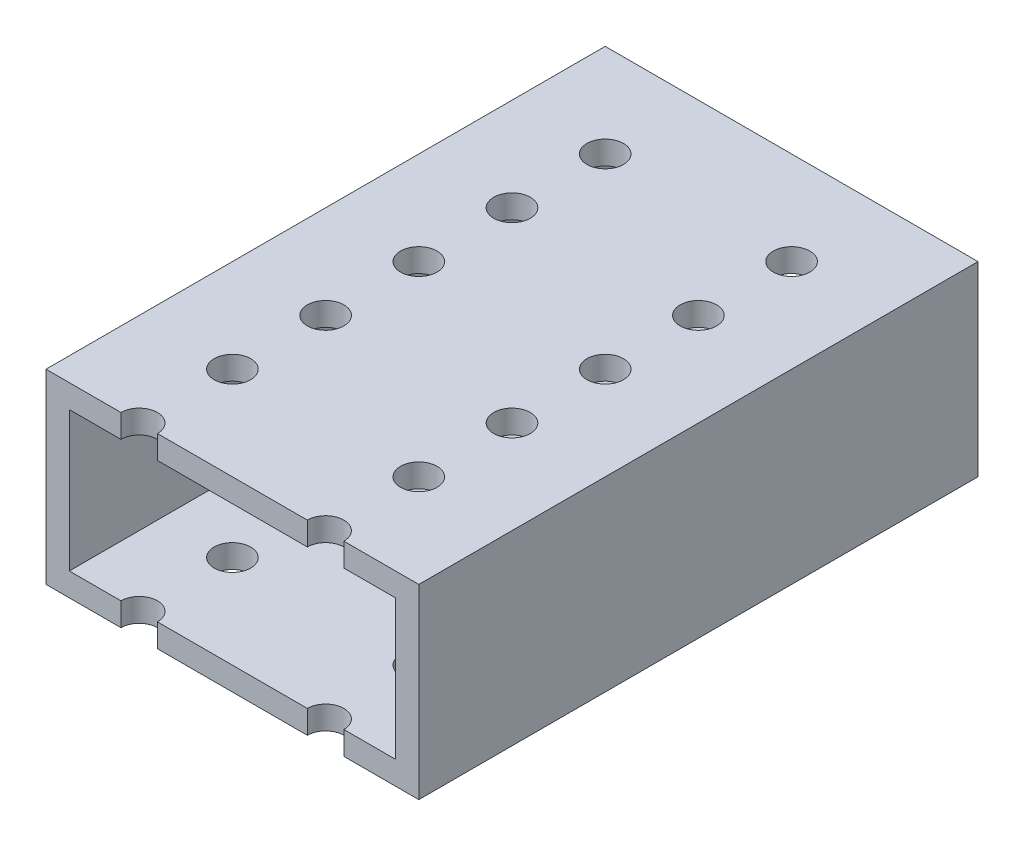
from build123d import *

# Parameters (mm, degrees)
SKETCH1_W           = 50.8
SKETCH1_H           = 25.4
BOSS_EXTRUDE1_DEPTH = 38.1
SHELL1_T            = -3.175
SKETCH2_R           = 2.4892
CUT_EXTRUDE1_DEPTH  = 63.5


with BuildPart() as part:
    # Sketch1 → Boss-Extrude1 (new, symmetric)
    with BuildSketch(Plane.XY):
        Rectangle(SKETCH1_W, SKETCH1_H)
    extrude(amount=BOSS_EXTRUDE1_DEPTH, both=True)

    # Shell1
    shell1_openings = [part.faces().sort_by_distance(p)[0] for p in [
        (0, 0, 38.1),
        (0, 0, -38.1),
    ]]
    offset(amount=SHELL1_T, openings=shell1_openings, kind=Kind.INTERSECTION)

    # Sketch2 → Cut-Extrude1 (cut, symmetric)
    with BuildSketch(Plane(origin=(0, 0, 0), x_dir=(1, 0, 0), z_dir=(0, 1, 0))):
        with Locations(Location((-12.7, 25.4, 0), (0, 0, 270))):
            Circle(SKETCH2_R)
        with Locations(Location((12.7, 25.4, 0), (0, 0, 270))):
            Circle(SKETCH2_R)
        with Locations(Location((12.7, 12.7, 0), (0, 0, 270))):
            Circle(SKETCH2_R)
        with Locations(Location((12.7, 0, 0), (0, 0, 270))):
            Circle(SKETCH2_R)
        with Locations(Location((12.7, -12.7, 0), (0, 0, 270))):
            Circle(SKETCH2_R)
        with Locations(Location((12.7, -25.4, 0), (0, 0, 270))):
            Circle(SKETCH2_R)
        with Locations((12.7, -38.1)):
            Circle(SKETCH2_R)
        with Locations(Location((-12.7, 12.7, 0), (0, 0, 270))):
            Circle(SKETCH2_R)
        with Locations(Location((-12.7, 0, 0), (0, 0, 270))):
            Circle(SKETCH2_R)
        with Locations(Location((-12.7, -12.7, 0), (0, 0, 270))):
            Circle(SKETCH2_R)
        with Locations(Location((-12.7, -25.4, 0), (0, 0, 270))):
            Circle(SKETCH2_R)
        with Locations((-12.7, -38.1)):
            Circle(SKETCH2_R)
    extrude(amount=CUT_EXTRUDE1_DEPTH, both=True, mode=Mode.SUBTRACT)


solid = part.part
